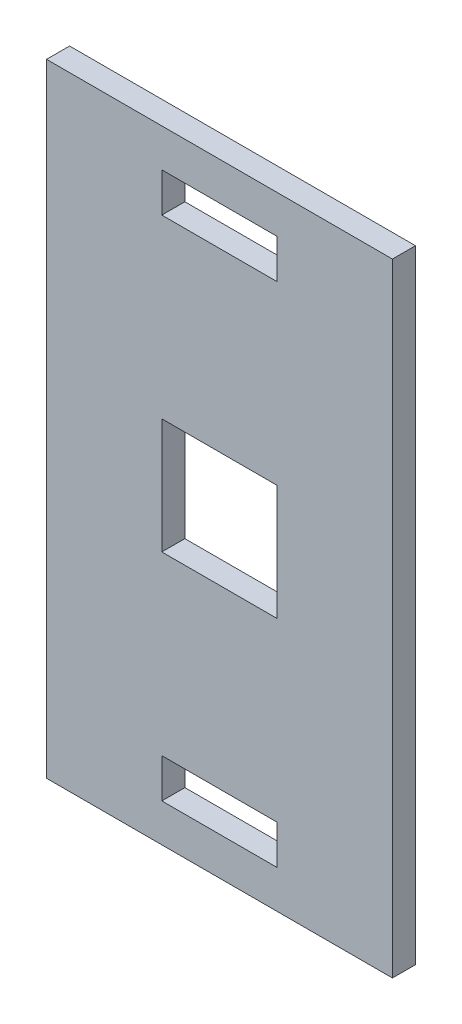
from build123d import *

# Parameters (mm, degrees)
SKETCH1_W                        = 30
SKETCH1_H                        = 54
PLATE_54X30_DEPTH                = 2
OPTICAL_WINDOW_10X10_START       = -0.1
SKETCH2_W                        = 10
SKETCH2_H                        = 10
OPTICAL_WINDOW_10X10_DEPTH       = 2.2
VERTICAL_M3_ADJUSTMENT_1_START   = -0.1
SKETCH3_W                        = 10
SKETCH3_H                        = 3.4
VERTICAL_M3_ADJUSTMENT_1_DEPTH   = 2.2
SKETCH4_W                        = 10
SKETCH4_H                        = 3.4
VERTICAL_M3_ADJUSTMENT_1_2_DEPTH = 2.2


with BuildPart() as part:
    # Sketch1 → Plate_54x30 (new body)
    with BuildSketch(Plane.XY):
        Rectangle(SKETCH1_W, SKETCH1_H)
    extrude(amount=PLATE_54X30_DEPTH)

    # Sketch2 → Optical_Window_10x10 (cut)
    with BuildSketch(Plane.XY.offset(OPTICAL_WINDOW_10X10_START)):
        Rectangle(SKETCH2_W, SKETCH2_H)
    extrude(amount=OPTICAL_WINDOW_10X10_DEPTH, mode=Mode.SUBTRACT)

    # Sketch3 → Vertical_M3_Adjustment_-1 (cut)
    with BuildSketch(Plane.XY.offset(VERTICAL_M3_ADJUSTMENT_1_START)):
        with Locations((0, -22)):
            Rectangle(SKETCH3_W, SKETCH3_H)
    extrude(amount=VERTICAL_M3_ADJUSTMENT_1_DEPTH, mode=Mode.SUBTRACT)

    # Sketch4 → Vertical_M3_Adjustment_1 2 (cut)
    with BuildSketch(Plane.XY.offset(VERTICAL_M3_ADJUSTMENT_1_START)):
        with Locations((0, 22)):
            Rectangle(SKETCH4_W, SKETCH4_H)
    extrude(amount=VERTICAL_M3_ADJUSTMENT_1_2_DEPTH, mode=Mode.SUBTRACT)


solid = part.part
